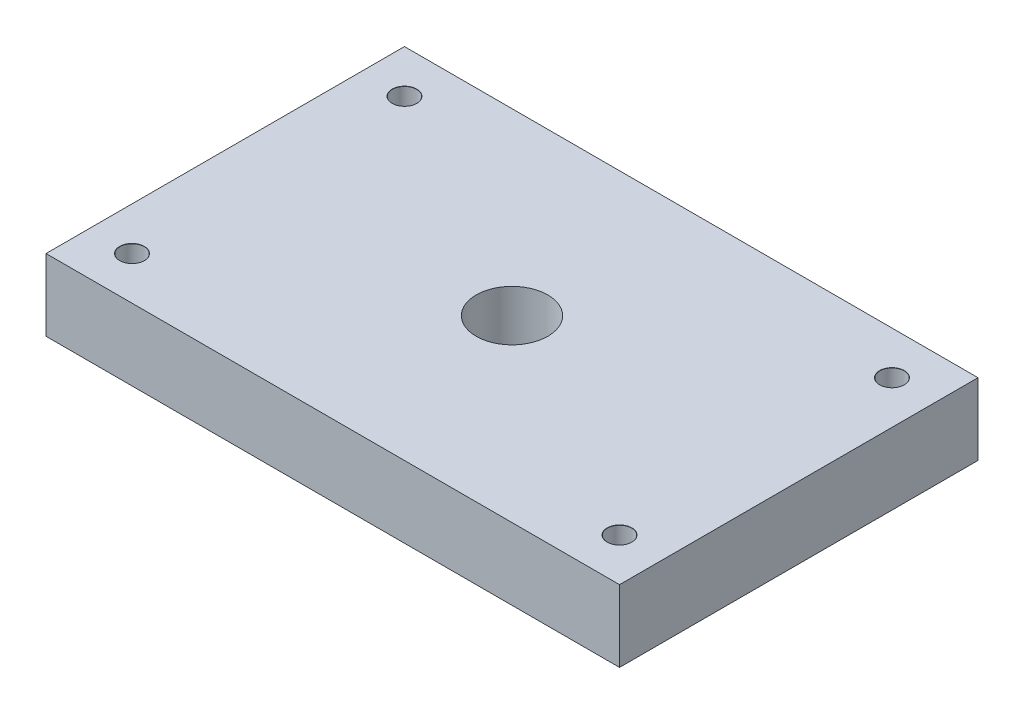
from build123d import *

# Parameters (mm, degrees)
SKETCH1_W                      = 80
SKETCH1_H                      = 50
BOSS_EXTRUDE1_DEPTH            = 10
SKETCH2_R                      = 5
CUT_EXTRUDE1_DEPTH             = 49.218253805
M3_CLEARANCE_HOLE1_D           = 3.4
M3_CLEARANCE_HOLE1_CSINK_D     = 3.45
M3_CLEARANCE_HOLE1_CSINK_ANGLE = 90


with BuildPart() as part:
    # Sketch1 → Boss-Extrude1 (new body)
    with BuildSketch(Plane(origin=(0, 0, 0), x_dir=(1, 0, 0), z_dir=(0, 1, 0))):
        Rectangle(SKETCH1_W, SKETCH1_H)
    extrude(amount=BOSS_EXTRUDE1_DEPTH)

    # Sketch2 → Cut-Extrude1 (cut, through all)
    with BuildSketch(Plane(origin=(0, 10, 0), x_dir=(1, 0, 0), z_dir=(0, 1, 0))):
        with Locations(Location((0, 0, 0), (0, 0, 270))):
            Circle(SKETCH2_R)
    extrude(amount=-CUT_EXTRUDE1_DEPTH, mode=Mode.SUBTRACT)

    # M3 Clearance Hole1 (through all)
    with Locations(Plane(origin=(0, 10, 0), x_dir=(1, 0, 0), z_dir=(0, 1, 0))):
        with Locations((-34, 19), (34, 19), (-34, -19), (34, -19)):
            CounterSinkHole(M3_CLEARANCE_HOLE1_D / 2, M3_CLEARANCE_HOLE1_CSINK_D / 2, counter_sink_angle=M3_CLEARANCE_HOLE1_CSINK_ANGLE)


solid = part.part
